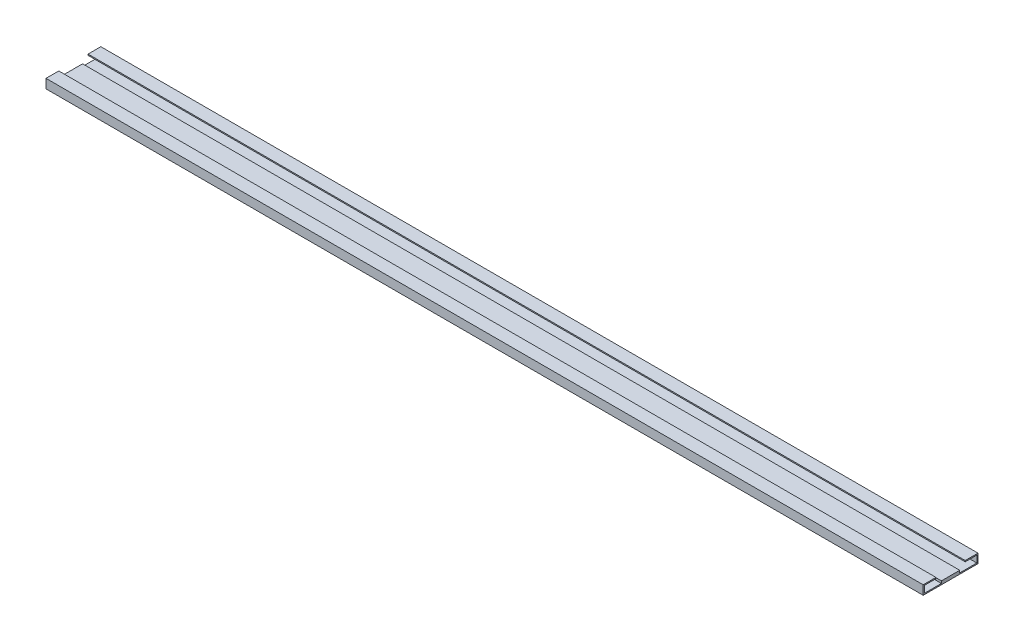
from build123d import *

# Parameters (mm, degrees)
SKETCH1_W           = 609.6
SKETCH1_H           = 38.1
BOSS_EXTRUDE1_DEPTH = 6.35
CUT_EXTRUDE1_DEPTH  = 609.6


with BuildPart() as part:
    # Sketch1 → Boss-Extrude1 (new body)
    with BuildSketch(Plane(origin=(0, 0, 0), x_dir=(1, 0, 0), z_dir=(0, 1, 0))):
        Rectangle(SKETCH1_W, SKETCH1_H)
    extrude(amount=BOSS_EXTRUDE1_DEPTH)

    # Sketch2 → Cut-Extrude1 (cut)
    with BuildSketch(Plane.ZY.offset(304.8)):
        Polygon((-10.16, 6.35), (-10.16, 5.55625), (-18.25625, 5.55625), (-18.25625, 0.79375), (-6.35, 0.79375), (-6.35, 2.38125), (6.35, 2.38125), (6.35, 0.79375), (18.25625, 0.79375), (18.25625, 5.55625), (10.16, 5.55625), (10.16, 6.35), align=None)
    extrude(amount=-CUT_EXTRUDE1_DEPTH, mode=Mode.SUBTRACT)


solid = part.part
